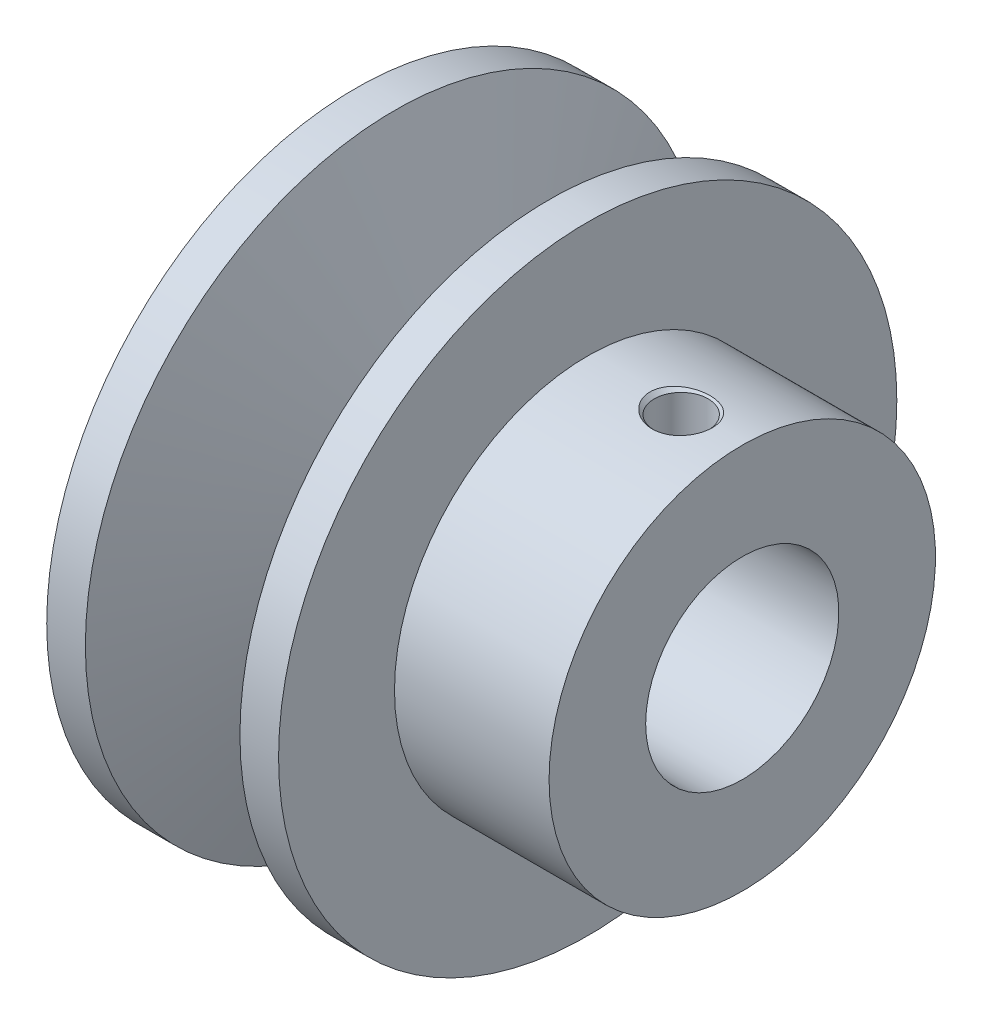
from build123d import *

# Parameters (mm, degrees)
M8X1_0_TAPPED_HOLE2_D           = 7
M8X1_0_TAPPED_HOLE2_DEPTH       = 19
M8X1_0_TAPPED_HOLE2_CSINK_D     = 8.05
M8X1_0_TAPPED_HOLE2_CSINK_ANGLE = 90
M8X1_0_TAPPED_HOLE2_TIP         = 2.103012167


with BuildPart() as part:
    # Sketch1 → Revolve2 (revolve)
    with BuildSketch(Plane.XY, mode=Mode.PRIVATE) as revolve2_sk:
        Polygon((5, 12.5), (0, 20), (0, 40), (5, 40), (12.279404685, 20), (17.720595315, 20), (25, 40), (30, 40), (30, 25), (50, 25), (50, 12.5), align=None)
    revolve(revolve2_sk.sketch.rotate(Axis((0, 0, 0), (1, 0, 0)), 90), axis=Axis((0, 0, 0), (1, 0, 0)))

    # M8x1.0 Tapped Hole2
    with Locations(Plane(origin=(42.095304981, 25, 0), x_dir=(0, 0, 1), z_dir=(0, 1, 0))):
        with Locations((0, 0)):
            CounterSinkHole(M8X1_0_TAPPED_HOLE2_D / 2, M8X1_0_TAPPED_HOLE2_CSINK_D / 2, depth=M8X1_0_TAPPED_HOLE2_DEPTH, counter_sink_angle=M8X1_0_TAPPED_HOLE2_CSINK_ANGLE)
            with Locations((0, 0, -(M8X1_0_TAPPED_HOLE2_DEPTH + M8X1_0_TAPPED_HOLE2_TIP / 2))):  # 118° drill point
                Cone(0, M8X1_0_TAPPED_HOLE2_D / 2, M8X1_0_TAPPED_HOLE2_TIP, mode=Mode.SUBTRACT)


solid = part.part
